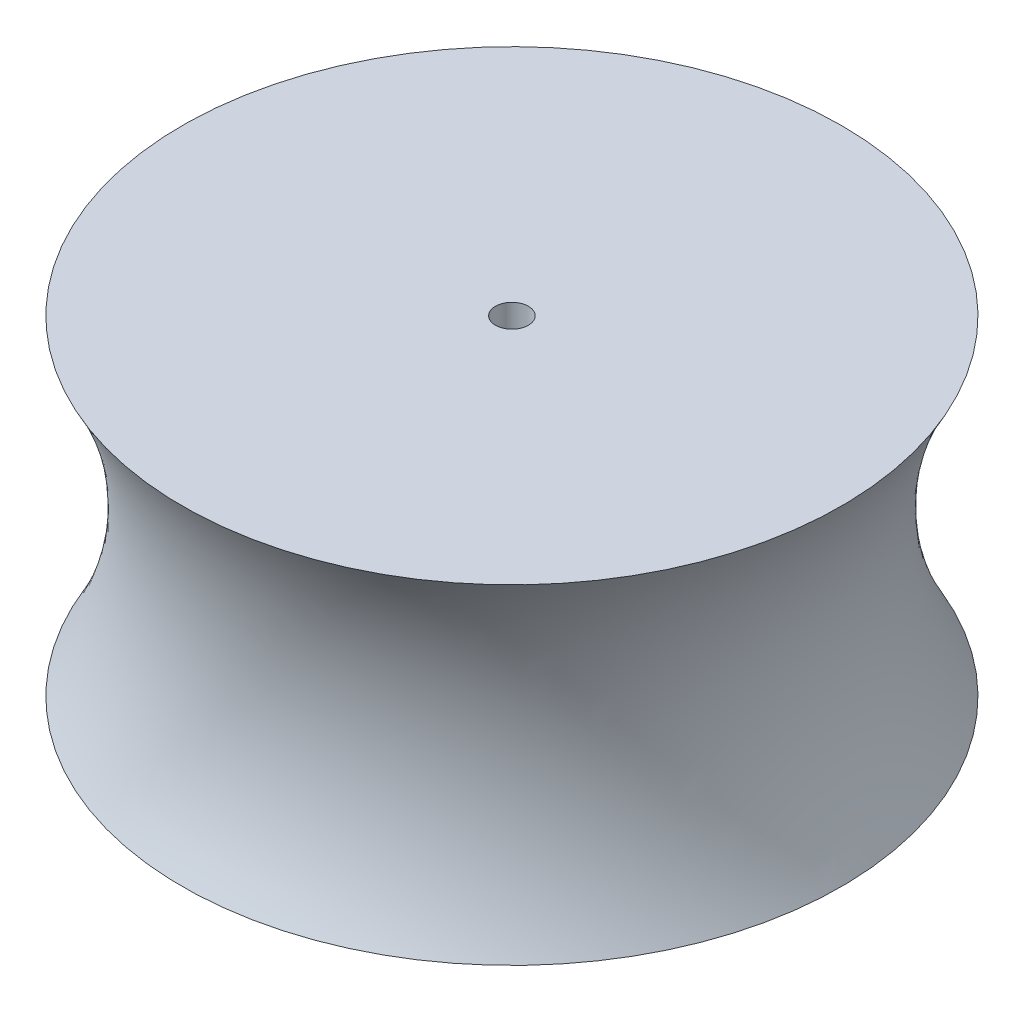
from build123d import *

# Parameters (mm, degrees)
SKETCH1_R           = 20
BOSS_EXTRUDE1_DEPTH = 20
SKETCH2_R           = 20
SKETCH3_R           = 1
CUT_EXTRUDE1_DEPTH  = 35.641016151


with BuildPart() as part:
    # Sketch1 → Boss-Extrude1 (new body)
    with BuildSketch(Plane(origin=(0, 0, 0), x_dir=(1, 0, 0), z_dir=(0, 1, 0))):
        with Locations(Location((0, 0, 0), (0, 0, 270))):
            Circle(SKETCH1_R)
    extrude(amount=BOSS_EXTRUDE1_DEPTH)

    # Sketch2 → Cut-Revolve1 (revolve, cut)
    with BuildSketch(Plane(origin=(0, 0, 0), x_dir=(0, 0, -1), z_dir=(1, 0, 0))):
        with Locations((37.320508076, 10)):
            Circle(SKETCH2_R)
    revolve(axis=Axis((0, 0, 0), (0, 1, 0)), mode=Mode.SUBTRACT)

    # Sketch3 → Cut-Extrude1 (cut, through all)
    with BuildSketch(Plane(origin=(0, 20, 0), x_dir=(1, 0, 0), z_dir=(0, 1, 0))):
        with Locations(Location((0, 0, 0), (0, 0, 270))):
            Circle(SKETCH3_R)
    extrude(amount=-CUT_EXTRUDE1_DEPTH, mode=Mode.SUBTRACT)


solid = part.part
